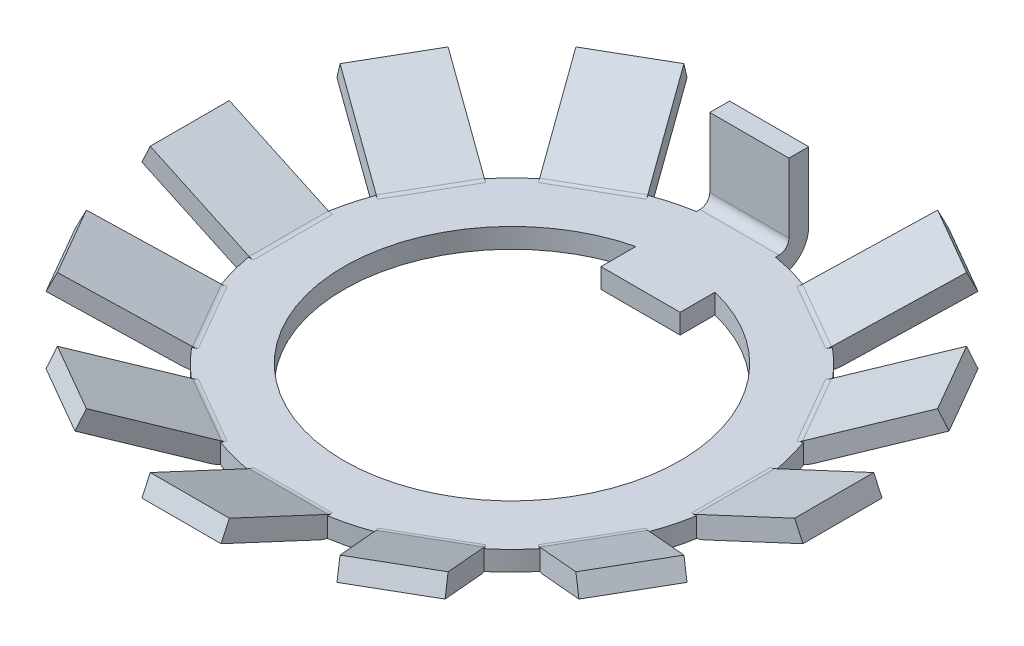
from build123d import *

# Parameters (mm, degrees)
ESQUISSE1_W             = 3
ESQUISSE1_H             = 1
LANGUETTE_PLI_E_DEPTH   = 2
LANGUETTE_DEPTH         = 2
NBR_DE_LANGUETTES_COUNT = 11
NBR_DE_LANGUETTES_ANGLE = 300


with BuildPart() as part:
    # Esquisse1 → Base (revolve)
    with BuildSketch(Plane.XY, mode=Mode.PRIVATE) as base_sk:
        with Locations((10, 0.5)):
            Rectangle(ESQUISSE1_W, ESQUISSE1_H)
    revolve(base_sk.sketch.rotate(Axis((0, 0, 0), (0, 1, 0)), 90), axis=Axis((0, 0, 0), (0, 1, 0)))

    # Esquisse3 → Languette pliée (add, symmetric)
    with BuildSketch(Plane(origin=(0, 0, 0), x_dir=(0, 0, -1), z_dir=(1, 0, 0))):
        with BuildLine():
            Line((12, 5), (12, 1.5))
            ThreePointArc((12, 1.5), (11.853553391, 1.146446609), (11.5, 1))
            Line((11.5, 1), (8.5, 1))
            Line((8.5, 1), (6.5, 1))
            Line((6.5, 1), (6.5, 0))
            Line((6.5, 0), (8.5, 0))
            Line((8.5, 0), (11.5, 0))
            ThreePointArc((11.5, 0), (12.560660172, 0.439339828), (13, 1.5))
            Line((13, 1.5), (13, 5))
            Line((13, 5), (12, 5))
        make_face()
    extrude(amount=LANGUETTE_PLI_E_DEPTH, both=True)

    # Esquisse2 → Languette (add, symmetric)
    with BuildSketch(Plane(origin=(0, 0, 0), x_dir=(-0.5000000000000071, 0, 0.8660254037844346), z_dir=(-0.8660254037844346, 0, -0.5000000000000071))):
        with BuildLine():
            Line((-8.5, 1), (-11.077381738, 1))
            ThreePointArc((-11.077381738, 1), (-11.185601545, 1.011851996), (-11.288690869, 1.046846106))
            Line((-11.288690869, 1.046846106), (-16.288690869, 3.378384397))
            Line((-16.288690869, 3.378384397), (-16.711309131, 2.47207661))
            Line((-16.711309131, 2.47207661), (-11.711309131, 0.140538319))
            ThreePointArc((-11.711309131, 0.140538319), (-11.402041159, 0.035555989), (-11.077381738, 0))
            Line((-11.077381738, 0), (-8.5, 0))
            Line((-8.5, 0), (-8.5, 1))
        make_face()
    languette = extrude(amount=LANGUETTE_DEPTH, both=True)

    # Nbr de languettes: Languette ×11 about axis
    nbr_de_languettes_axis = Axis((0, 0, 0), (0, -1, 0))
    for i in range(1, NBR_DE_LANGUETTES_COUNT):
        add(languette.rotate(nbr_de_languettes_axis, i * NBR_DE_LANGUETTES_ANGLE / (NBR_DE_LANGUETTES_COUNT - 1)))


solid = part.part
